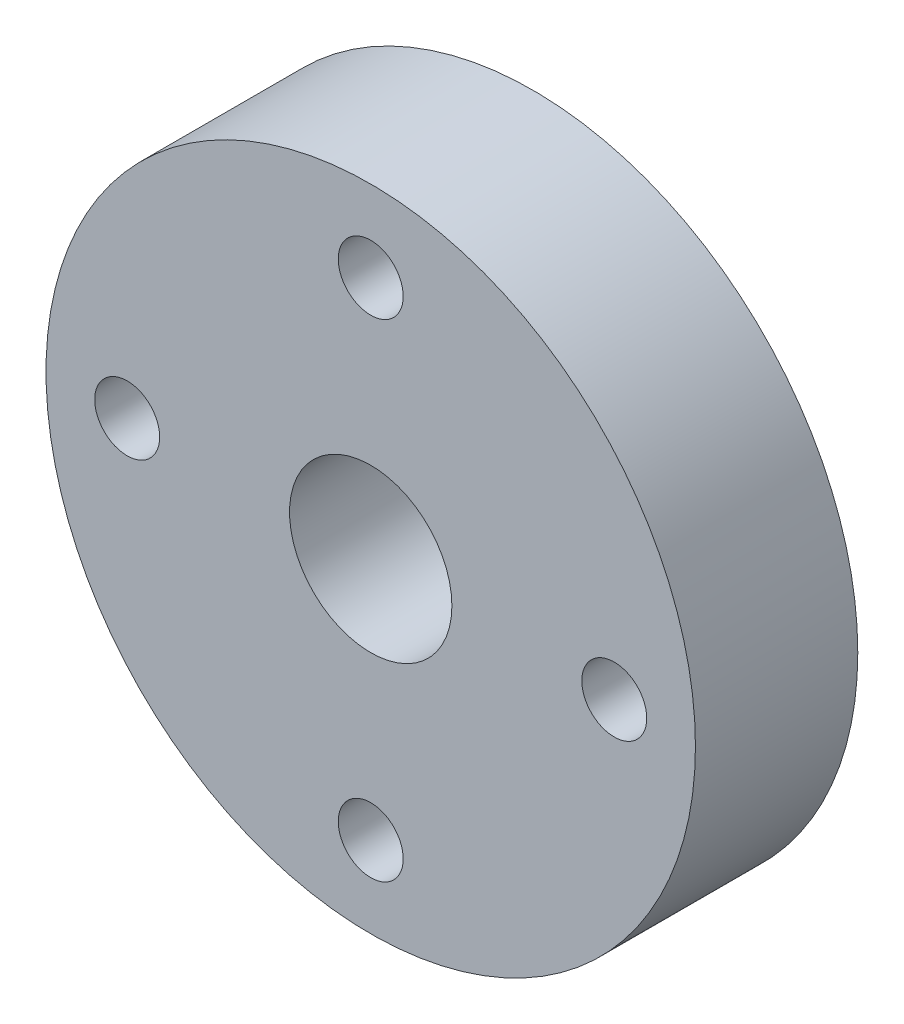
from build123d import *

# Parameters (mm, degrees)
SKETCH1_R           = 100
SKETCH1_R_2         = 10
SKETCH1_R_3         = 25
BOSS_EXTRUDE2_DEPTH = 50


with BuildPart() as part:
    # Sketch1 → Boss-Extrude2 (new body)
    with BuildSketch(Plane.XY):
        with Locations((-251.982778427, 110.09527936)):
            Circle(SKETCH1_R)
        with Locations((-251.982778427, 185.09527936)):
            Circle(SKETCH1_R_2, mode=Mode.SUBTRACT)
        with Locations((-176.982778427, 110.09527936)):
            Circle(SKETCH1_R_2, mode=Mode.SUBTRACT)
        with Locations((-251.982778427, 35.09527936)):
            Circle(SKETCH1_R_2, mode=Mode.SUBTRACT)
        with Locations((-326.982778427, 110.09527936)):
            Circle(SKETCH1_R_2, mode=Mode.SUBTRACT)
        with Locations((-251.982778427, 110.09527936)):
            Circle(SKETCH1_R_3, mode=Mode.SUBTRACT)
    extrude(amount=BOSS_EXTRUDE2_DEPTH)


solid = part.part
